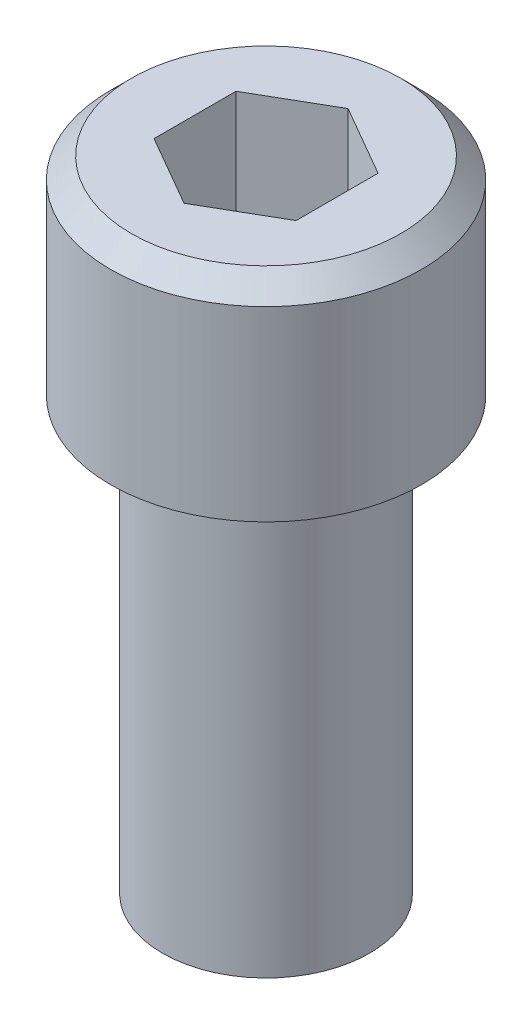
from build123d import *

# Parameters (mm, degrees)
CROQUIS4_R               = 18
SALIENTE_EXTRUIR3_DEPTH  = 24
CHAFL_N2_SIZE            = 2.4
CROQUIS6_18_R            = 12
SALIENTE_EXTRUIR20_DEPTH = 50


with BuildPart() as part:
    # Croquis4 → Saliente-Extruir3 (new body)
    with BuildSketch(Plane(origin=(0, 0, 0), x_dir=(1, 0, 0), z_dir=(0, 1, 0))):
        Circle(CROQUIS4_R)
        Polygon((0, 9.5), (-8.227241336, 4.75), (-8.227241336, -4.75), (0, -9.5), (8.227241336, -4.75), (8.227241336, 4.75), align=None, mode=Mode.SUBTRACT)
    extrude(amount=SALIENTE_EXTRUIR3_DEPTH)

    # Chaflán2
    chafl_n2_edges = [part.edges().sort_by_distance(p)[0] for p in [
        (-18, 24, 0),
    ]]
    chamfer(chafl_n2_edges, length=CHAFL_N2_SIZE)

    # Croquis5 → Revolución2 (revolve)
    with BuildSketch(Plane.XY):
        Polygon((0, 0), (0, 6.515172443), (9.5, 12), (18, 12), (18, 0), align=None)
    revolve(axis=Axis((0, 0, 0), (0, 1, 0)))

    # Croquis6<18> → Saliente-Extruir20 (add)
    with BuildSketch(Plane.XZ):
        Circle(CROQUIS6_18_R)
    extrude(amount=SALIENTE_EXTRUIR20_DEPTH)


solid = part.part
